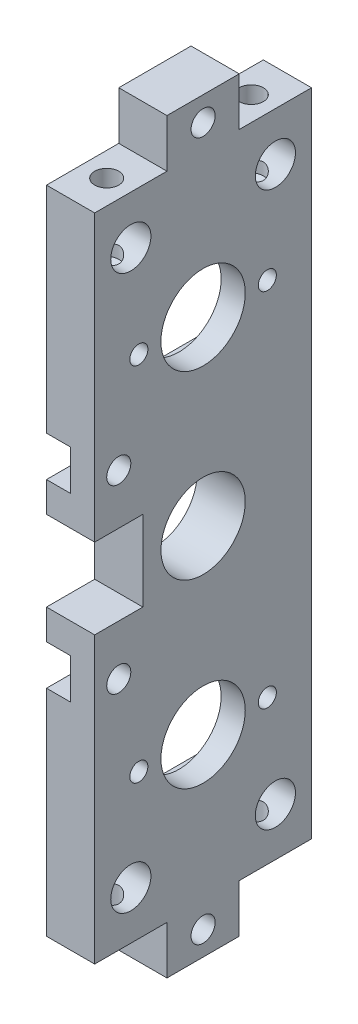
from build123d import *

# Parameters (mm, degrees)
SKETCH2_W                         = 54
SKETCH2_H                         = 162
SKETCH2_R                         = 10.5
BOSS_EXTRUDE1_DEPTH               = 12
SKETCH3_W                         = 18
SKETCH3_H                         = 12
BOSS_EXTRUDE2_DEPTH               = 12
CUT_EXTRUDE1_REACH                = 99.581
SKETCH4_R                         = 2.25
LPATTERN1_COUNT                   = 2
LPATTERN1_PITCH                   = 90
CUT_EXTRUDE2_DEPTH                = 6
CUT_EXTRUDE3_REACH                = 99.581
SKETCH6_W                         = 24
SKETCH6_H                         = 20
CUT_EXTRUDE4_REACH                = 99.581
SKETCH7_R                         = 3
CUT_EXTRUDE5_DEPTH                = 6
CUT_EXTRUDE6_REACH                = 99.581
SKETCH9_R                         = 5
HOLE1_D                           = 6
HOLE1_CBORE_D                     = 10
HOLE1_CBORE_DEPTH                 = 6
F_6_0_6_DIAMETER_HOLE1_AT_2_COUNT = 2
F_6_0_6_DIAMETER_HOLE1_AT_2_PITCH = 36


with BuildPart() as part:
    # Sketch2 → Boss-Extrude1 (new body)
    with BuildSketch(Plane(origin=(0, 0, 0), x_dir=(0, 0, -1), z_dir=(1, 0, 0))):
        Rectangle(SKETCH2_W, SKETCH2_H)
        Circle(SKETCH2_R, mode=Mode.SUBTRACT)
        with Locations((0, 45)):
            Circle(SKETCH2_R, mode=Mode.SUBTRACT)
        with Locations((0, -45)):
            Circle(SKETCH2_R, mode=Mode.SUBTRACT)
    extrude(amount=BOSS_EXTRUDE1_DEPTH)

    # Sketch3 → Boss-Extrude2 (add)
    with BuildSketch(Plane(origin=(12, 0, 0), x_dir=(0, 0, -1), z_dir=(1, 0, 0))):
        with Locations((0, -87)):
            Rectangle(SKETCH3_W, SKETCH3_H)
    boss_extrude2 = extrude(amount=-BOSS_EXTRUDE2_DEPTH)

    # Mirror1: Boss-Extrude2 across plane
    add(boss_extrude2.mirror(Plane.ZX))

    # Sketch4 → Cut-Extrude1 (cut, up to next)
    with BuildSketch(Plane(origin=(12, 0, 0), x_dir=(0, 0, -1), z_dir=(1, 0, 0)), mode=Mode.PRIVATE) as cut_extrude1_sk1:
        with Locations((-16, -45)):
            Circle(SKETCH4_R)
    cut_extrude1_tool1 = extrude(cut_extrude1_sk1.sketch, amount=-CUT_EXTRUDE1_REACH, mode=Mode.PRIVATE) & part.part
    # Sketch4 → Cut-Extrude1 (cut, up to next)
    with BuildSketch(Plane(origin=(12, 0, 0), x_dir=(0, 0, -1), z_dir=(1, 0, 0)), mode=Mode.PRIVATE) as cut_extrude1_sk2:
        with Locations((16, -45)):
            Circle(SKETCH4_R)
    cut_extrude1_tool2 = extrude(cut_extrude1_sk2.sketch, amount=-CUT_EXTRUDE1_REACH, mode=Mode.PRIVATE) & part.part
    cut_extrude1_1 = cut_extrude1_tool1.solids().sort_by_distance((12, -45, 16))[0]
    add(cut_extrude1_1, mode=Mode.SUBTRACT)
    cut_extrude1_2 = cut_extrude1_tool2.solids().sort_by_distance((12, -45, -16))[0]
    add(cut_extrude1_2, mode=Mode.SUBTRACT)
    cut_extrude1 = cut_extrude1_1 + cut_extrude1_2  # Cut-Extrude1 as one shape, for the pattern or mirror that repeats it

    # LPattern1: Cut-Extrude1 ×2
    with Locations(*[(0, i * LPATTERN1_PITCH, 0) for i in range(1, LPATTERN1_COUNT)]):
        add(cut_extrude1, mode=Mode.SUBTRACT)

    # Sketch5 → Cut-Extrude2 (cut)
    with BuildSketch(Plane.ZY):
        with BuildLine():
            Line((-16.992645468, 60.5), (16.992645468, 60.5))
            ThreePointArc((16.992645468, 60.5), (23, 45), (16.992645468, 29.5))
            Line((16.992645468, 29.5), (-16.992645468, 29.5))
            ThreePointArc((-16.992645468, 29.5), (-23, 45), (-16.992645468, 60.5))
        make_face()
        with BuildLine():
            Line((-16.992645468, -29.5), (16.992645468, -29.5))
            ThreePointArc((16.992645468, -29.5), (23, -45), (16.992645468, -60.5))
            Line((16.992645468, -60.5), (-16.992645468, -60.5))
            ThreePointArc((-16.992645468, -60.5), (-23, -45), (-16.992645468, -29.5))
        make_face()
    extrude(amount=-CUT_EXTRUDE2_DEPTH, mode=Mode.SUBTRACT)

    # Sketch6 → Cut-Extrude3 (cut, up to next)
    with BuildSketch(Plane.ZY, mode=Mode.PRIVATE) as cut_extrude3_sk1:
        with Locations((27, 0)):
            Rectangle(SKETCH6_W, SKETCH6_H)
    cut_extrude3_tool1 = extrude(cut_extrude3_sk1.sketch, amount=-CUT_EXTRUDE3_REACH, mode=Mode.PRIVATE) & part.part
    add(cut_extrude3_tool1.solids().sort_by_distance((0, 0, 27))[0], mode=Mode.SUBTRACT)

    # Sketch7 → Cut-Extrude4 (cut, up to next)
    with BuildSketch(Plane.ZY, mode=Mode.PRIVATE) as cut_extrude4_sk1:
        with Locations((21, 22.5)):
            Circle(SKETCH7_R)
    cut_extrude4_tool1 = extrude(cut_extrude4_sk1.sketch, amount=-CUT_EXTRUDE4_REACH, mode=Mode.PRIVATE) & part.part
    # Sketch7 → Cut-Extrude4 (cut, up to next)
    with BuildSketch(Plane.ZY, mode=Mode.PRIVATE) as cut_extrude4_sk2:
        with Locations((21, -22.5)):
            Circle(SKETCH7_R)
    cut_extrude4_tool2 = extrude(cut_extrude4_sk2.sketch, amount=-CUT_EXTRUDE4_REACH, mode=Mode.PRIVATE) & part.part
    add(cut_extrude4_tool1.solids().sort_by_distance((0, 22.5, 21))[0], mode=Mode.SUBTRACT)
    add(cut_extrude4_tool2.solids().sort_by_distance((0, -22.5, 21))[0], mode=Mode.SUBTRACT)

    # Sketch8 → Cut-Extrude5 (cut)
    with BuildSketch(Plane.ZY):
        with BuildLine():
            Line((21, 27.5), (27, 27.5))
            Line((27, 27.5), (27, 17.5))
            Line((27, 17.5), (21, 17.5))
            ThreePointArc((21, 17.5), (16, 22.5), (21, 27.5))
        make_face()
        with BuildLine():
            Line((21, -27.5), (27, -27.5))
            Line((27, -27.5), (27, -17.5))
            Line((27, -17.5), (21, -17.5))
            ThreePointArc((21, -17.5), (16, -22.5), (21, -27.5))
        make_face()
    extrude(amount=-CUT_EXTRUDE5_DEPTH, mode=Mode.SUBTRACT)

    # Sketch9 → Cut-Extrude6 (cut, up to next)
    with BuildSketch(Plane.ZY, mode=Mode.PRIVATE) as cut_extrude6_sk1:
        with Locations((-18, -69)):
            Circle(SKETCH9_R)
    cut_extrude6_tool1 = extrude(cut_extrude6_sk1.sketch, amount=-CUT_EXTRUDE6_REACH, mode=Mode.PRIVATE) & part.part
    # Sketch9 → Cut-Extrude6 (cut, up to next)
    with BuildSketch(Plane.ZY, mode=Mode.PRIVATE) as cut_extrude6_sk2:
        with Locations((18, -69)):
            Circle(SKETCH9_R)
    cut_extrude6_tool2 = extrude(cut_extrude6_sk2.sketch, amount=-CUT_EXTRUDE6_REACH, mode=Mode.PRIVATE) & part.part
    cut_extrude6_1 = cut_extrude6_tool1.solids().sort_by_distance((0, -69, -18))[0]
    add(cut_extrude6_1, mode=Mode.SUBTRACT)
    cut_extrude6_2 = cut_extrude6_tool2.solids().sort_by_distance((0, -69, 18))[0]
    add(cut_extrude6_2, mode=Mode.SUBTRACT)
    cut_extrude6 = cut_extrude6_1 + cut_extrude6_2  # Cut-Extrude6 as one shape, for the pattern or mirror that repeats it

    # Hole1 (through all)
    with Locations(Plane.ZY):
        with Locations((0, -87)):
            hole1 = CounterBoreHole(HOLE1_D / 2, HOLE1_CBORE_D / 2, HOLE1_CBORE_DEPTH)

    # Sketch13 → Ø6.0 (6) Diameter Hole1 (revolve, cut)
    with BuildSketch(Plane(origin=(6, -81, -18), x_dir=(0, 0, -1), z_dir=(1, 0, 0))):
        Polygon((0, 0), (0, 20.802581857), (3, 19), (3, 0), align=None)
    f_6_0_6_diameter_hole1 = revolve(axis=Axis((6, -87.35, -18), (0, 1, 0)), mode=Mode.SUBTRACT)

    # Ø6.0 (6) Diameter Hole1 at 2: Ø6.0 (6) Diameter Hole1 ×2
    with Locations(*[(0, 0, i * F_6_0_6_DIAMETER_HOLE1_AT_2_PITCH) for i in range(1, F_6_0_6_DIAMETER_HOLE1_AT_2_COUNT)]):
        add(f_6_0_6_diameter_hole1, mode=Mode.SUBTRACT)

    # Mirror2: Cut-Extrude6, Hole1, Ø6.0 (6) Diameter Hole1 across plane
    add(cut_extrude6.mirror(Plane.ZX), mode=Mode.SUBTRACT)
    add(hole1.mirror(Plane.ZX), mode=Mode.SUBTRACT)
    add(f_6_0_6_diameter_hole1.mirror(Plane.ZX), mode=Mode.SUBTRACT)

    # Mirror2 copy 1 sketch → Mirror2 copy 1 (revolve, cut)
    with BuildSketch(Plane(origin=(6, 81, 18), x_dir=(0, 0, -1), z_dir=(1, 0, 0))):
        Polygon((0, 0), (0, -20.802581857), (3, -19), (3, 0), align=None)
    revolve(axis=Axis((6, 87.35, 18), (0, 1, 0)), mode=Mode.SUBTRACT)


solid = part.part
